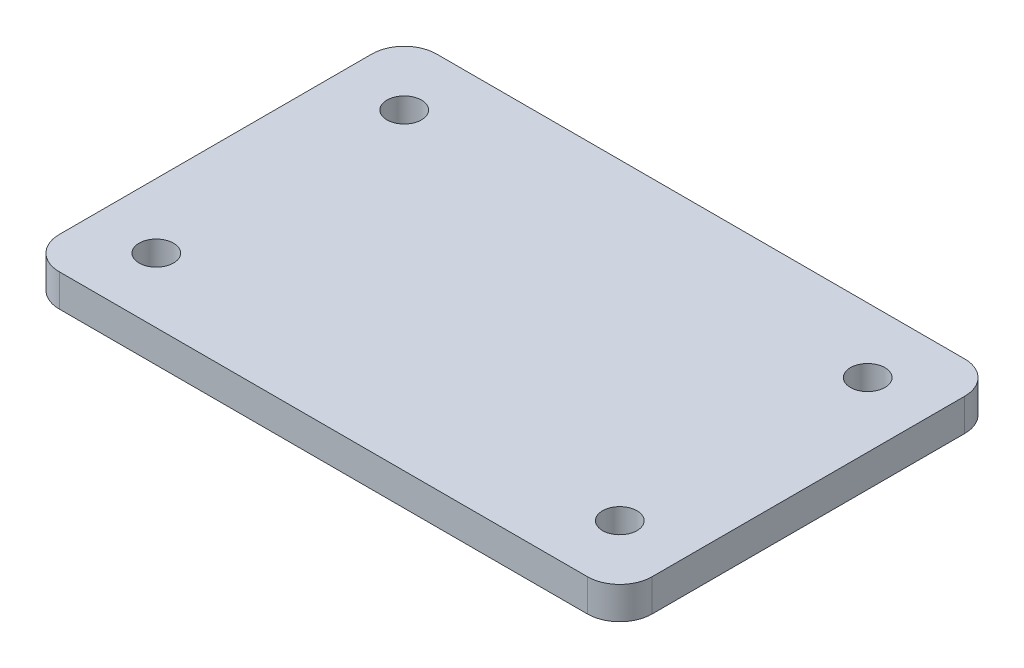
from build123d import *

# Parameters (mm, degrees)
SKETCH_1_W          = 55
SKETCH_1_H          = 35
EXTRUDE_1_DEPTH     = 3
SKETCH_2_R          = 1.6
CUT_EXTRUDE_1_DEPTH = 3
FILLET_1_R          = 3


with BuildPart() as part:
    # 草图1 → 凸台-拉伸1 (new body)
    with BuildSketch(Plane(origin=(0, 0, 0), x_dir=(1, 0, 0), z_dir=(0, 1, 0))):
        with Locations((27.5, 17.5)):
            Rectangle(SKETCH_1_W, SKETCH_1_H)
    extrude(amount=EXTRUDE_1_DEPTH)

    # 草图2 → 切除-拉伸1 (cut)
    with BuildSketch(Plane(origin=(0, 3, 0), x_dir=(1, 0, 0), z_dir=(0, 1, 0))):
        with Locations(Location((6, 29, 0), (0, 0, 270))):
            Circle(SKETCH_2_R)
        with Locations(Location((49, 29, 0), (0, 0, 270))):
            Circle(SKETCH_2_R)
        with Locations(Location((49, 6, 0), (0, 0, 270))):
            Circle(SKETCH_2_R)
        with Locations(Location((6, 6, 0), (0, 0, 270))):
            Circle(SKETCH_2_R)
    extrude(amount=-CUT_EXTRUDE_1_DEPTH, mode=Mode.SUBTRACT)

    # 圆角1
    fillet_1_edges = [part.edges().sort_by_distance(p)[0] for p in [
        (0, 1.5, -35),
        (55, 1.5, -35),
        (55, 1.5, 0),
        (0, 1.5, 0),
    ]]
    fillet(fillet_1_edges, radius=FILLET_1_R)


solid = part.part
